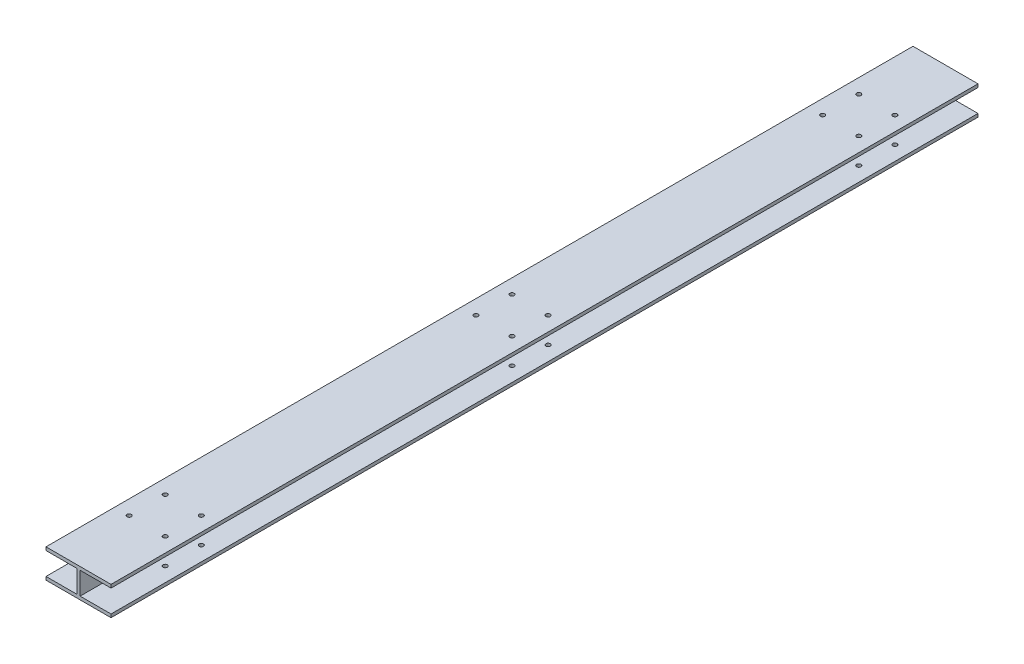
from build123d import *

# Parameters (mm, degrees)
BOSS_EXTRUDE4_DEPTH       = 1200
CUT_EXTRUDE4_REACH        = 1203.096
SKETCH8_R                 = 3
LPATTERN1_COUNT           = 2
LPATTERN1_PITCH           = 480
LPATTERN1_COL_COUNT       = 2
LPATTERN1_COL_PITCH       = 480
SKETCH16_R                = 3
CUT_EXTRUDE11_DEPTH       = 1202.509467295
LPATTERN3_COUNT           = 2
LPATTERN3_PITCH           = 50
LPATTERN3_COUNT_DIR2      = 2
LPATTERN3_PITCH_DIR2      = 50
LPATTERN4_COPY_1_SKETCH_R = 3
LPATTERN4_COPY_1_DEPTH    = 1202.509467295
LPATTERN4_COPY_2_SKETCH_R = 3
LPATTERN4_COPY_2_DEPTH    = 1202.509467295
LPATTERN4_COPY_3_SKETCH_R = 3
LPATTERN4_COPY_3_DEPTH    = 1202.509467295
LPATTERN4_COPY_4_SKETCH_R = 3
LPATTERN4_COPY_4_DEPTH    = 1202.509467295
LPATTERN4_COPY_5_SKETCH_R = 3
LPATTERN4_COPY_5_DEPTH    = 1202.509467295
LPATTERN4_COPY_6_SKETCH_R = 3
LPATTERN4_COPY_6_DEPTH    = 1202.509467295
LPATTERN4_COPY_7_SKETCH_R = 3
LPATTERN4_COPY_7_DEPTH    = 1202.509467295
LPATTERN4_COPY_8_SKETCH_R = 3
LPATTERN4_COPY_8_DEPTH    = 1202.509467295
SKETCH25_R                = 2.1
CUT_EXTRUDE18_DEPTH       = 10


with BuildPart() as part:
    # Sketch1<6> → Boss-Extrude4 (new body)
    with BuildSketch(Plane.XY):
        Polygon((-2.25, 15.5), (-45, 15.5), (-45, 20), (45, 20), (45, 15.5), (2.25, 15.5), (2.25, -15.5), (45, -15.5), (45, -20), (-45, -20), (-45, -15.5), (-2.25, -15.5), align=None)
    extrude(amount=BOSS_EXTRUDE4_DEPTH)

    # Sketch8 → Cut-Extrude4 (cut, up to next)
    with BuildSketch(Plane(origin=(2.25, 0, 0), x_dir=(0, 0, -1), z_dir=(1, 0, 0)), mode=Mode.PRIVATE) as cut_extrude4_sk1:
        with Locations((-580.75, 0)):
            Circle(SKETCH8_R)
    cut_extrude4_tool1 = extrude(cut_extrude4_sk1.sketch, amount=-CUT_EXTRUDE4_REACH, mode=Mode.PRIVATE) & part.part
    cut_extrude4 = cut_extrude4_tool1.solids().sort_by_distance((2.25, 0, 580.75))[0]
    add(cut_extrude4, mode=Mode.SUBTRACT)

    # LPattern1: Cut-Extrude4 ×2
    with Locations(*[(0, 0, i * LPATTERN1_PITCH) for i in range(1, LPATTERN1_COUNT)]):
        add(cut_extrude4, mode=Mode.SUBTRACT)

    # LPattern1 col: Cut-Extrude4 ×2
    with Locations(*[(0, 0, -i * LPATTERN1_COL_PITCH) for i in range(1, LPATTERN1_COL_COUNT)]):
        add(cut_extrude4, mode=Mode.SUBTRACT)

    # Sketch16 → Cut-Extrude11 (cut, through all)
    with BuildSketch(Plane(origin=(0, 20, 0), x_dir=(1, 0, 0), z_dir=(0, 1, 0))):
        with Locations((25, -95)):
            Circle(SKETCH16_R)
    cut_extrude11 = extrude(amount=-CUT_EXTRUDE11_DEPTH, mode=Mode.SUBTRACT)

    # LPattern3: Cut-Extrude11 2 × 2
    with Locations(*[(-j * LPATTERN3_PITCH_DIR2, 0, i * LPATTERN3_PITCH) for i in range(LPATTERN3_COUNT) for j in range(LPATTERN3_COUNT_DIR2) if (i, j) != (0, 0)]):
        add(cut_extrude11, mode=Mode.SUBTRACT)

    # LPattern4 copy 1 sketch → LPattern4 copy 1 (cut, through all)
    with BuildSketch(Plane(origin=(-50, 20, 480), x_dir=(1, 0, 0), z_dir=(0, 1, 0))):
        with Locations((25, -95)):
            Circle(LPATTERN4_COPY_1_SKETCH_R)
    extrude(amount=-LPATTERN4_COPY_1_DEPTH, mode=Mode.SUBTRACT)

    # LPattern4 copy 2 sketch → LPattern4 copy 2 (cut, through all)
    with BuildSketch(Plane(origin=(-50, 20, 960), x_dir=(1, 0, 0), z_dir=(0, 1, 0))):
        with Locations((25, -95)):
            Circle(LPATTERN4_COPY_2_SKETCH_R)
    extrude(amount=-LPATTERN4_COPY_2_DEPTH, mode=Mode.SUBTRACT)

    # LPattern4 copy 3 sketch → LPattern4 copy 3 (cut, through all)
    with BuildSketch(Plane(origin=(0, 20, 530), x_dir=(1, 0, 0), z_dir=(0, 1, 0))):
        with Locations((25, -95)):
            Circle(LPATTERN4_COPY_3_SKETCH_R)
    extrude(amount=-LPATTERN4_COPY_3_DEPTH, mode=Mode.SUBTRACT)

    # LPattern4 copy 4 sketch → LPattern4 copy 4 (cut, through all)
    with BuildSketch(Plane(origin=(0, 20, 1010), x_dir=(1, 0, 0), z_dir=(0, 1, 0))):
        with Locations((25, -95)):
            Circle(LPATTERN4_COPY_4_SKETCH_R)
    extrude(amount=-LPATTERN4_COPY_4_DEPTH, mode=Mode.SUBTRACT)

    # LPattern4 copy 5 sketch → LPattern4 copy 5 (cut, through all)
    with BuildSketch(Plane(origin=(-50, 20, 530), x_dir=(1, 0, 0), z_dir=(0, 1, 0))):
        with Locations((25, -95)):
            Circle(LPATTERN4_COPY_5_SKETCH_R)
    extrude(amount=-LPATTERN4_COPY_5_DEPTH, mode=Mode.SUBTRACT)

    # LPattern4 copy 6 sketch → LPattern4 copy 6 (cut, through all)
    with BuildSketch(Plane(origin=(-50, 20, 1010), x_dir=(1, 0, 0), z_dir=(0, 1, 0))):
        with Locations((25, -95)):
            Circle(LPATTERN4_COPY_6_SKETCH_R)
    extrude(amount=-LPATTERN4_COPY_6_DEPTH, mode=Mode.SUBTRACT)

    # LPattern4 copy 7 sketch → LPattern4 copy 7 (cut, through all)
    with BuildSketch(Plane(origin=(0, 20, 480), x_dir=(1, 0, 0), z_dir=(0, 1, 0))):
        with Locations((25, -95)):
            Circle(LPATTERN4_COPY_7_SKETCH_R)
    extrude(amount=-LPATTERN4_COPY_7_DEPTH, mode=Mode.SUBTRACT)

    # LPattern4 copy 8 sketch → LPattern4 copy 8 (cut, through all)
    with BuildSketch(Plane(origin=(0, 20, 960), x_dir=(1, 0, 0), z_dir=(0, 1, 0))):
        with Locations((25, -95)):
            Circle(LPATTERN4_COPY_8_SKETCH_R)
    extrude(amount=-LPATTERN4_COPY_8_DEPTH, mode=Mode.SUBTRACT)

    # Sketch25 → Cut-Extrude18 (cut)
    with BuildSketch(Plane(origin=(2.25, 0, 0), x_dir=(0, 0, -1), z_dir=(1, 0, 0))):
        with Locations((-614.63, 0)):
            Circle(SKETCH25_R)
        with Locations((-632.63, 0)):
            Circle(SKETCH25_R)
    extrude(amount=-CUT_EXTRUDE18_DEPTH, mode=Mode.SUBTRACT)


solid = part.part
